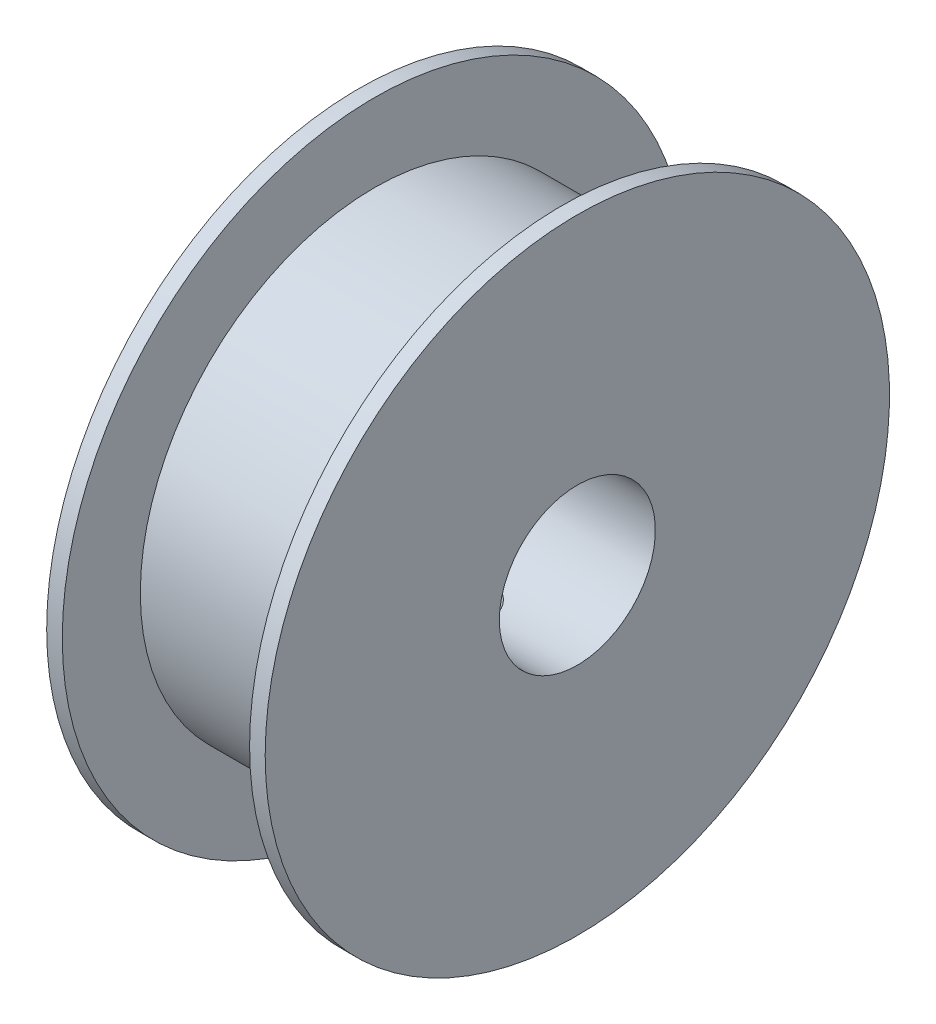
from build123d import *

# Parameters (mm, degrees)
SKETCH_3_R          = 1.6
CUT_EXTRUDE_1_DEPTH = 64.287719075


with BuildPart() as part:
    # ｽｹｯﾁ2 → 回転1 (revolve)
    with BuildSketch(Plane(origin=(0, 0, 0), x_dir=(1, 0, 0), z_dir=(0, 1, 0)), mode=Mode.PRIVATE) as revolve_1_sk:
        Polygon((-44.73085458, -0.056036178), (-44.73085458, -15.056036178), (-30.73085458, -15.056036178), (-30.73085458, -0.056036178), (-31.73085458, -0.056036178), (-31.73085458, -5.056036178), (-43.73085458, -5.056036178), (-43.73085458, -0.056036178), align=None)
    revolve(revolve_1_sk.sketch.rotate(Axis((-49.849406884, 0, 20.056036178), (1, 0, 0)), 180), axis=Axis((-49.849406884, 0, 20.056036178), (1, 0, 0)))

    # ｽｹｯﾁ3 → ｶｯﾄ - 押し出し1 (cut, through all)
    with BuildSketch(Plane(origin=(0, 0, 0), x_dir=(1, 0, 0), z_dir=(0, 1, 0))):
        with Locations(Location((-37.73085458, -20.056036178, 0), (0, 0, 270))):
            Circle(SKETCH_3_R)
    extrude(amount=-CUT_EXTRUDE_1_DEPTH, mode=Mode.SUBTRACT)


solid = part.part
